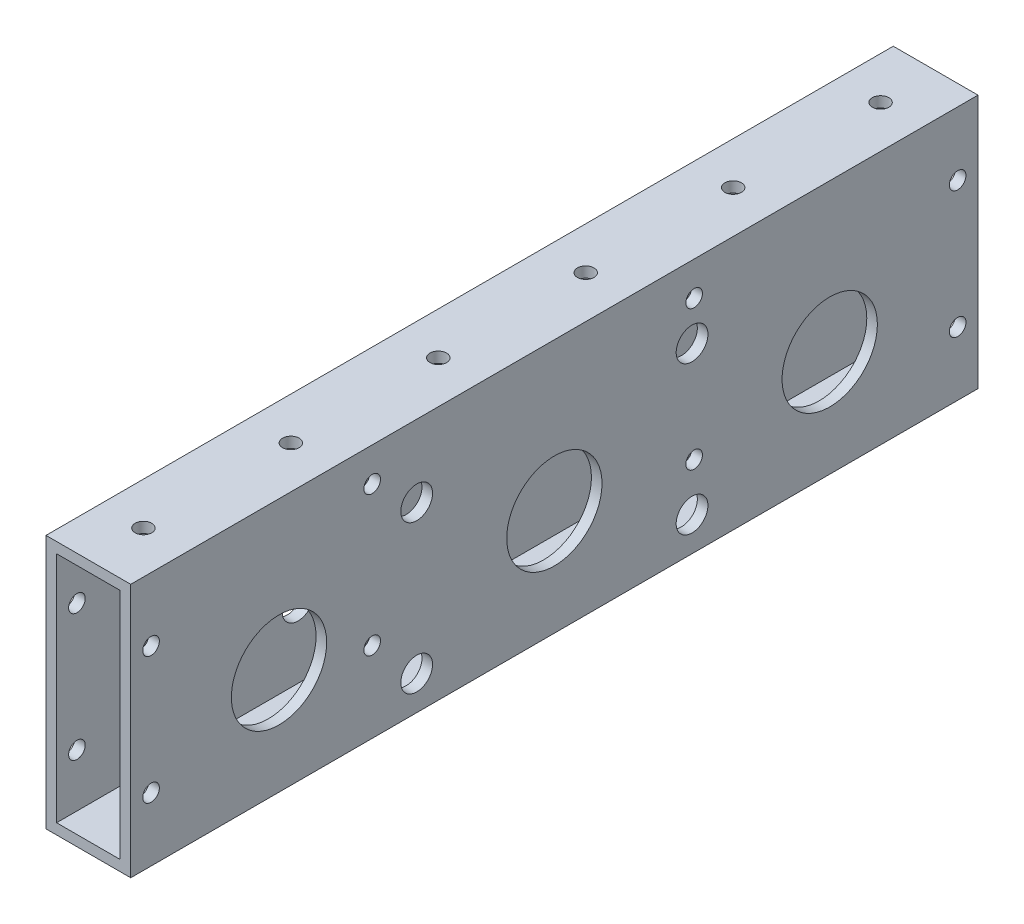
from build123d import *

# Parameters (mm, degrees)
SKETCH1_W                        = 254
SKETCH1_H                        = 76.2
BOSS_EXTRUDE1_DEPTH              = 25.4
SHELL1_T                         = -3.175
SKETCH2_R                        = 14.2875
SKETCH2_R_2                      = 2.4892
CUT_EXTRUDE1_DEPTH               = 136.002851822
F_10_CLEARANCE_HOLE1_D           = 4.9784
F_3_8_0_375_DIAMETER_HOLE1_D     = 9.525
F_3_8_0_375_DIAMETER_HOLE1_DEPTH = 10.922
F_3_8_0_375_DIAMETER_HOLE1_TIP   = 2.861598698
F_3_8_0_375_DIAMETER_HOLE2_D     = 9.525
F_3_8_0_375_DIAMETER_HOLE2_DEPTH = 10.922
F_3_8_0_375_DIAMETER_HOLE2_TIP   = 2.861598698
SKETCH11_R                       = 2.4892
CUT_EXTRUDE2_DEPTH               = 151.268426491


with BuildPart() as part:
    # Sketch1 → Boss-Extrude1 (new body)
    with BuildSketch(Plane(origin=(0, 0, 0), x_dir=(0, 0, -1), z_dir=(1, 0, 0))):
        Rectangle(SKETCH1_W, SKETCH1_H)
    extrude(amount=BOSS_EXTRUDE1_DEPTH)

    # Shell1
    shell1_openings = [part.faces().sort_by_distance(p)[0] for p in [
        (12.7, 0, 127),
        (12.7, 0, -127),
    ]]
    offset(amount=SHELL1_T, openings=shell1_openings, kind=Kind.INTERSECTION)

    # Sketch2 → Cut-Extrude1 (cut, through all)
    with BuildSketch(Plane(origin=(25.4, 0, 0), x_dir=(0, 0, -1), z_dir=(1, 0, 0))):
        with Locations((0, -6.35)):
            Circle(SKETCH2_R)
        with Locations((-82.55, -6.35)):
            Circle(SKETCH2_R)
        with Locations((82.55, -6.35)):
            Circle(SKETCH2_R)
        with Locations((-41.275, 16.51)):
            Circle(SKETCH2_R_2)
        with Locations((-41.275, -27.94)):
            Circle(SKETCH2_R_2)
        with Locations((41.275, -27.94)):
            Circle(SKETCH2_R_2)
        with Locations((41.275, 16.51)):
            Circle(SKETCH2_R_2)
        with Locations((-54.61, 27.94)):
            Circle(SKETCH2_R_2)
        with Locations((-54.61, -13.97)):
            Circle(SKETCH2_R_2)
        with Locations((41.91, -13.97)):
            Circle(SKETCH2_R_2)
        with Locations((41.91, 27.94)):
            Circle(SKETCH2_R_2)
    extrude(amount=-CUT_EXTRUDE1_DEPTH, mode=Mode.SUBTRACT)

    # #10 Clearance Hole1 (through all)
    with Locations(Plane(origin=(25.4, 0, 0), x_dir=(0, 0, -1), z_dir=(1, 0, 0))):
        with Locations((-120.904, 19.05), (-120.904, -19.05)):
            f_10_clearance_hole1 = Hole(F_10_CLEARANCE_HOLE1_D / 2)

    # Mirror1: #10 Clearance Hole1 across plane
    add(f_10_clearance_hole1.mirror(Plane.XY), mode=Mode.SUBTRACT)

    # 3/8 (0.375) Diameter Hole1
    with Locations(Plane.ZY):
        with Locations((54.61, 27.94), (54.61, -13.97), (-41.91, -13.97), (-41.91, 27.94)):
            Hole(F_3_8_0_375_DIAMETER_HOLE1_D / 2, depth=F_3_8_0_375_DIAMETER_HOLE1_DEPTH)
            with Locations((0, 0, -(F_3_8_0_375_DIAMETER_HOLE1_DEPTH + F_3_8_0_375_DIAMETER_HOLE1_TIP / 2))):  # 118° drill point
                Cone(0, F_3_8_0_375_DIAMETER_HOLE1_D / 2, F_3_8_0_375_DIAMETER_HOLE1_TIP, mode=Mode.SUBTRACT)

    # 3/8 (0.375) Diameter Hole2
    with Locations(Plane(origin=(25.4, 0, 0), x_dir=(0, 0, -1), z_dir=(1, 0, 0))):
        with Locations((-41.275, 16.51), (-41.275, -27.94), (41.275, 16.51), (41.275, -27.94)):
            Hole(F_3_8_0_375_DIAMETER_HOLE2_D / 2, depth=F_3_8_0_375_DIAMETER_HOLE2_DEPTH)
            with Locations((0, 0, -(F_3_8_0_375_DIAMETER_HOLE2_DEPTH + F_3_8_0_375_DIAMETER_HOLE2_TIP / 2))):  # 118° drill point
                Cone(0, F_3_8_0_375_DIAMETER_HOLE2_D / 2, F_3_8_0_375_DIAMETER_HOLE2_TIP, mode=Mode.SUBTRACT)

    # Sketch11 → Cut-Extrude2 (cut, through all)
    with BuildSketch(Plane.XZ.offset(38.1)):
        with Locations(Location((12.7, -110.49, 0), (0, 0, 270))):
            Circle(SKETCH11_R)
        with Locations(Location((12.7, -66.294, 0), (0, 0, 270))):
            Circle(SKETCH11_R)
        with Locations(Location((12.7, -22.098, 0), (0, 0, 270))):
            Circle(SKETCH11_R)
        with Locations(Location((12.7, 22.098, 0), (0, 0, 270))):
            Circle(SKETCH11_R)
        with Locations(Location((12.7, 66.294, 0), (0, 0, 270))):
            Circle(SKETCH11_R)
        with Locations(Location((12.7, 110.49, 0), (0, 0, 270))):
            Circle(SKETCH11_R)
    extrude(amount=-CUT_EXTRUDE2_DEPTH, mode=Mode.SUBTRACT)


solid = part.part
